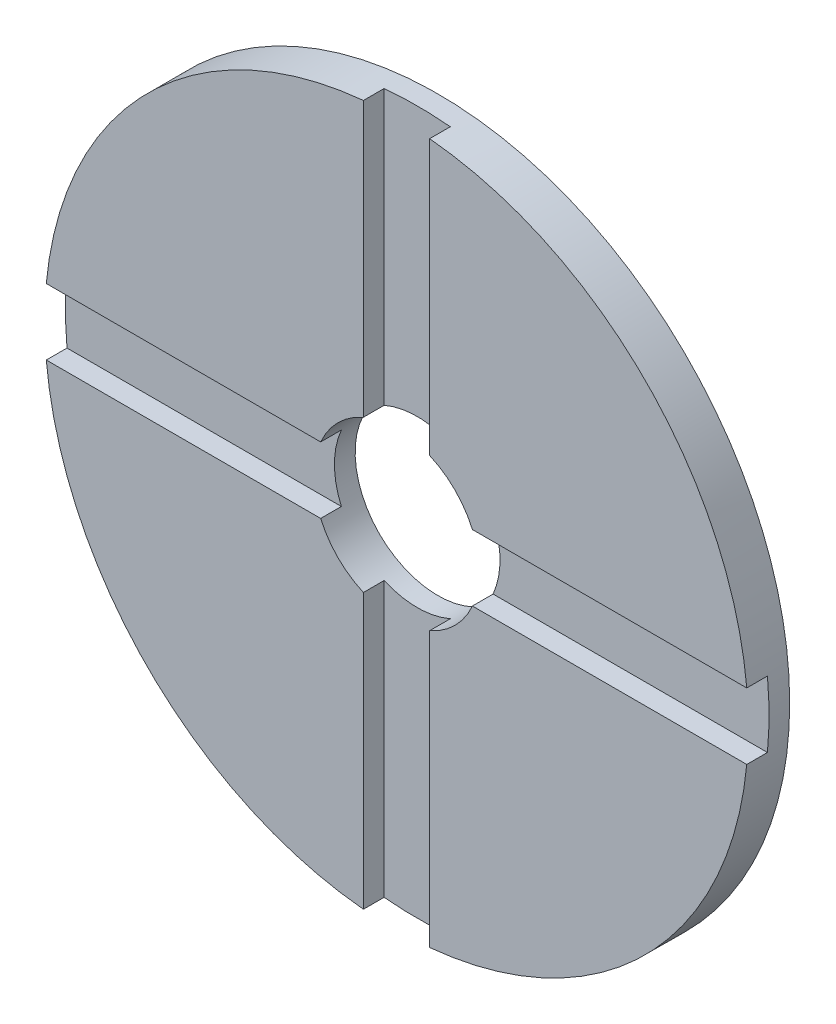
from build123d import *

# Parameters (mm, degrees)
SKETCH2_R           = 85
SKETCH2_R_2         = 20
BOSS_EXTRUDE1_DEPTH = 10
CUT_EXTRUDE1_START  = -5
CUT_EXTRUDE1_DEPTH  = 5


with BuildPart() as part:
    # Sketch2 → Boss-Extrude1 (new body)
    with BuildSketch(Plane.XY):
        Circle(SKETCH2_R)
        Circle(SKETCH2_R_2, mode=Mode.SUBTRACT)
    extrude(amount=BOSS_EXTRUDE1_DEPTH)

    # Sketch3 → Cut-Extrude1 (cut)
    with BuildSketch(Plane.XY.offset(10).offset(CUT_EXTRUDE1_START)):
        with BuildLine():
            Line((-18.33030278, 8), (-84.622691992, 8))
            ThreePointArc((-84.622691992, 8), (-85, 0), (-84.622691992, -8))
            Line((-84.622691992, -8), (-18.33030278, -8))
            ThreePointArc((-18.33030278, -8), (-20, 0), (-18.33030278, 8))
        make_face()
        with BuildLine():
            ThreePointArc((85, 0), (84.905620601, 4.00444632), (84.622691992, 8))
            Line((84.622691992, 8), (18.33030278, 8))
            ThreePointArc((18.33030278, 8), (19.578126259, 4.086192874), (20, 0))
            ThreePointArc((20, 0), (19.578126259, -4.086192874), (18.33030278, -8))
            Line((18.33030278, -8), (84.622691992, -8))
            ThreePointArc((84.622691992, -8), (84.905620601, -4.00444632), (85, 0))
        make_face()
        with BuildLine():
            ThreePointArc((8, 84.622691992), (0, 85), (-8, 84.622691992))
            Line((-8, 84.622691992), (-8, 18.33030278))
            ThreePointArc((-8, 18.33030278), (0, 20), (8, 18.33030278))
            Line((8, 18.33030278), (8, 84.622691992))
        make_face()
        with BuildLine():
            Line((-8, -18.33030278), (-8, -84.622691992))
            ThreePointArc((-8, -84.622691992), (0, -85), (8, -84.622691992))
            Line((8, -84.622691992), (8, -18.33030278))
            ThreePointArc((8, -18.33030278), (0, -20), (-8, -18.33030278))
        make_face()
    extrude(amount=CUT_EXTRUDE1_DEPTH, mode=Mode.SUBTRACT)


solid = part.part
